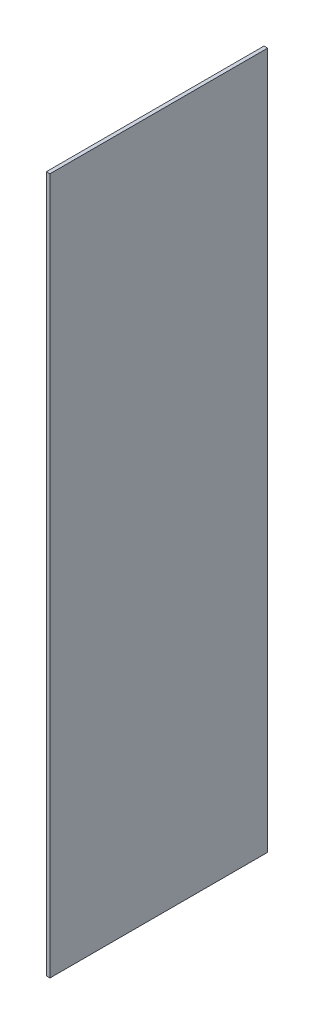
from build123d import *

# Parameters (mm, degrees)
SKETCH2_W           = 12.7
SKETCH2_H           = 762
BOSS_EXTRUDE1_DEPTH = 2438.4


with BuildPart() as part:
    # Sketch2 → Boss-Extrude1 (new body)
    with BuildSketch(Plane(origin=(0, 0, 0), x_dir=(1, 0, 0), z_dir=(0, 1, 0))):
        Rectangle(SKETCH2_W, SKETCH2_H)
    extrude(amount=BOSS_EXTRUDE1_DEPTH)


solid = part.part
